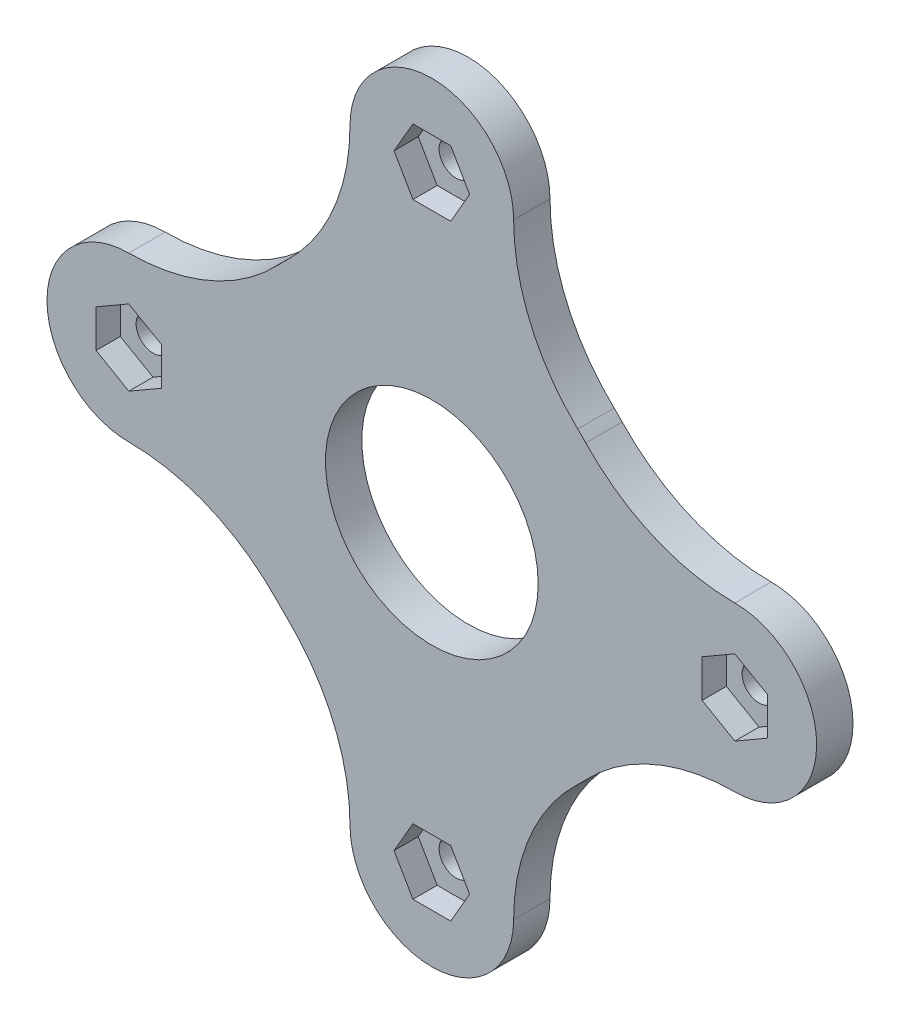
from build123d import *

# Parameters (mm, degrees)
SKETCH1_R           = 1.4
BOSS_EXTRUDE1_DEPTH = 3
CUT_EXTRUDE1_DEPTH  = 2
CUT_EXTRUDE2_REACH  = 47.001
SKETCH3_R           = 8.775


with BuildPart() as part:
    # Sketch1 → Boss-Extrude1 (new body)
    with BuildSketch(Plane.XY):
        with BuildLine():
            ThreePointArc((6.75, 25), (0, 31.75), (-6.75, 25))
            ThreePointArc((-6.75, 25), (-8.128131702, 18.306346632), (-12.038357667, 12.701493797))
            ThreePointArc((-12.038357667, 12.701493797), (-12.374368671, 12.374368671), (-12.701493797, 12.038357667))
            ThreePointArc((-12.701493797, 12.038357667), (-18.306346632, 8.128131702), (-25, 6.75))
            ThreePointArc((-25, 6.75), (-31.75, 0), (-25, -6.75))
            ThreePointArc((-25, -6.75), (-18.306346632, -8.128131702), (-12.701493797, -12.038357667))
            ThreePointArc((-12.701493797, -12.038357667), (-12.374368671, -12.374368671), (-12.038357667, -12.701493797))
            ThreePointArc((-12.038357667, -12.701493797), (-8.128131702, -18.306346632), (-6.75, -25))
            ThreePointArc((-6.75, -25), (0, -31.75), (6.75, -25))
            ThreePointArc((6.75, -25), (8.128131702, -18.306346632), (12.038357667, -12.701493797))
            ThreePointArc((12.038357667, -12.701493797), (12.374368671, -12.374368671), (12.701493797, -12.038357667))
            ThreePointArc((12.701493797, -12.038357667), (18.306346632, -8.128131702), (25, -6.75))
            ThreePointArc((25, -6.75), (31.75, 0), (25, 6.75))
            ThreePointArc((25, 6.75), (18.306346632, 8.128131702), (12.701493797, 12.038357667))
            ThreePointArc((12.701493797, 12.038357667), (12.374368671, 12.374368671), (12.038357667, 12.701493797))
            ThreePointArc((12.038357667, 12.701493797), (8.128131702, 18.306346632), (6.75, 25))
        make_face()
        with Locations((0, 25)):
            Circle(SKETCH1_R, mode=Mode.SUBTRACT)
        with Locations((-25, 0)):
            Circle(SKETCH1_R, mode=Mode.SUBTRACT)
        with Locations((0, -25)):
            Circle(SKETCH1_R, mode=Mode.SUBTRACT)
        with Locations((25, 0)):
            Circle(SKETCH1_R, mode=Mode.SUBTRACT)
    extrude(amount=BOSS_EXTRUDE1_DEPTH)

    # Sketch2 → Cut-Extrude1 (cut)
    with BuildSketch(Plane.XY.offset(3)):
        Polygon((3.117691454, 25), (1.558845727, 27.7), (-1.558845727, 27.7), (-3.117691454, 25), (-1.558845727, 22.3), (1.558845727, 22.3), align=None)
        Polygon((25, 3.117691454), (22.3, 1.558845727), (22.3, -1.558845727), (25, -3.117691454), (27.7, -1.558845727), (27.7, 1.558845727), align=None)
        Polygon((3.117691454, -25), (1.558845727, -22.3), (-1.558845727, -22.3), (-3.117691454, -25), (-1.558845727, -27.7), (1.558845727, -27.7), align=None)
        Polygon((-25, -3.117691454), (-22.3, -1.558845727), (-22.3, 1.558845727), (-25, 3.117691454), (-27.7, 1.558845727), (-27.7, -1.558845727), align=None)
    extrude(amount=-CUT_EXTRUDE1_DEPTH, mode=Mode.SUBTRACT)

    # Sketch3 → Cut-Extrude2 (cut, up to next)
    with BuildSketch(Plane.XY.offset(3), mode=Mode.PRIVATE) as cut_extrude2_sk1:
        Circle(SKETCH3_R)
    cut_extrude2_tool1 = extrude(cut_extrude2_sk1.sketch, amount=-CUT_EXTRUDE2_REACH, mode=Mode.PRIVATE) & part.part
    add(cut_extrude2_tool1.solids().sort_by_distance((0, 0, 3))[0], mode=Mode.SUBTRACT)


solid = part.part
